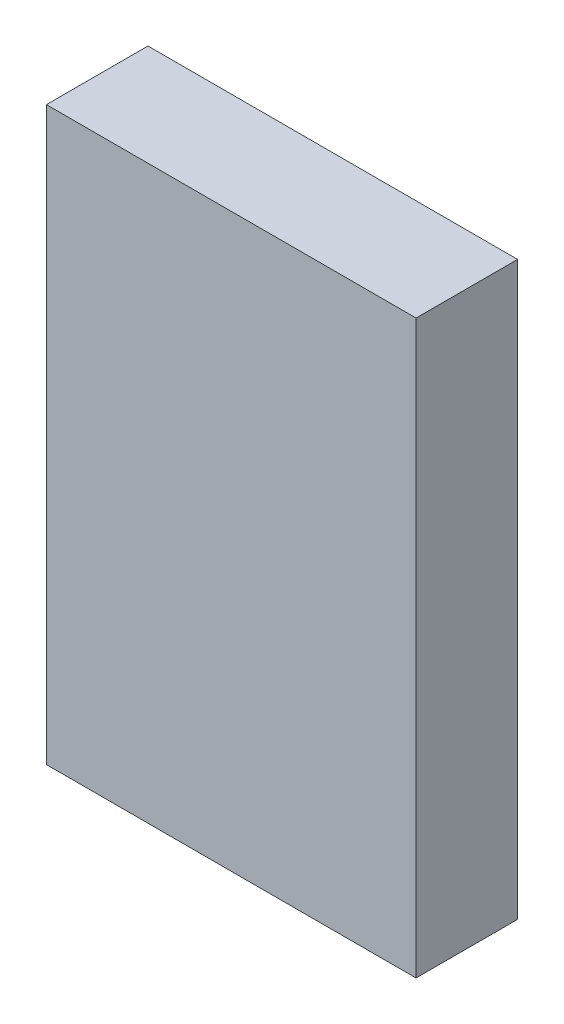
from build123d import *

# Parameters (mm, degrees)
ESBO_O1_W                = 87.88
ESBO_O1_H                = 135.89
RESSALTO_EXTRUS_O1_DEPTH = 24.14


with BuildPart() as part:
    # Esboço1 → Ressalto-extrusão1 (new body)
    with BuildSketch(Plane.XY):
        Rectangle(ESBO_O1_W, ESBO_O1_H)
    extrude(amount=RESSALTO_EXTRUS_O1_DEPTH)


solid = part.part
